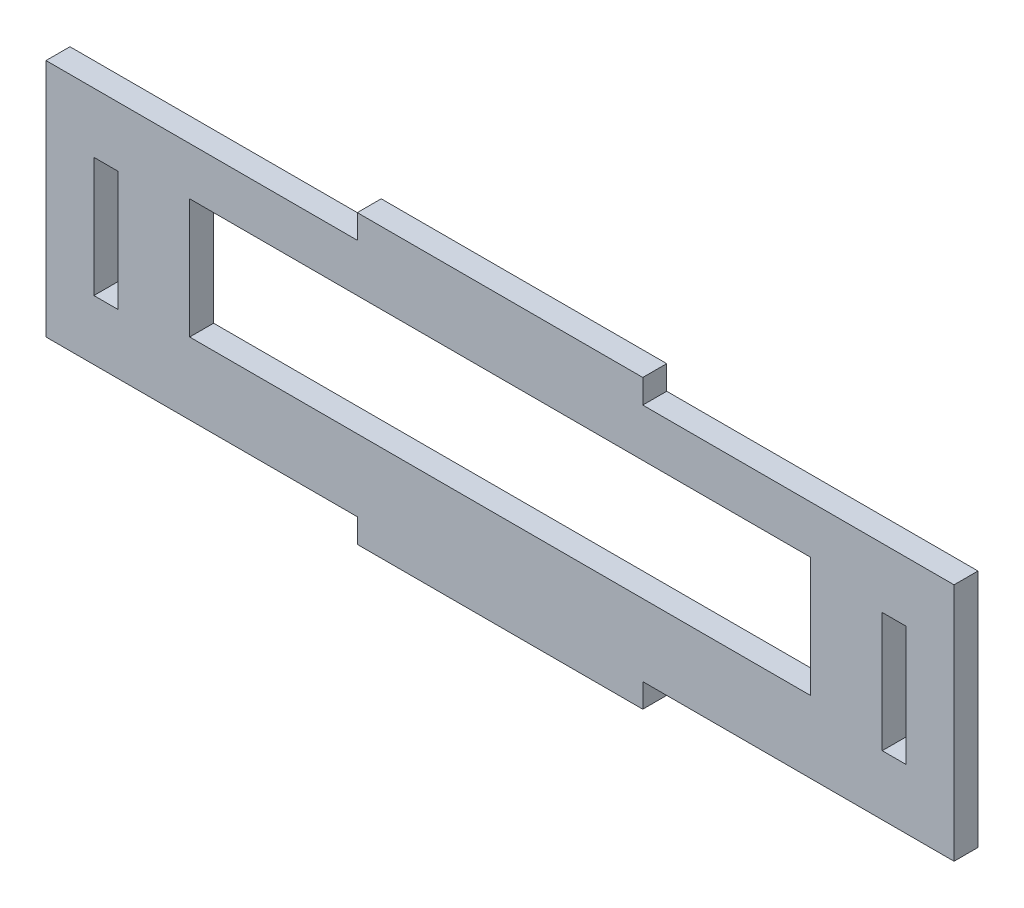
from build123d import *

# Parameters (mm, degrees)
SKETCH1_W           = 51.848
SKETCH1_H           = 10
SKETCH1_W_2         = 2
BOSS_EXTRUDE1_DEPTH = 2


with BuildPart() as part:
    # Sketch1 → Boss-Extrude1 (new body)
    with BuildSketch(Plane.XY):
        Polygon((0, 0), (24, 0), (24, -2), (47.848, -2), (47.848, 0), (71.848, 0), (73.848, 0), (73.848, 20), (71.848, 20), (47.848, 20), (47.848, 22), (24, 22), (24, 20), (0, 20), (-2, 20), (-2, 0), align=None)
        with Locations((35.924, 11)):
            Rectangle(SKETCH1_W, SKETCH1_H, mode=Mode.SUBTRACT)
        with Locations((3, 10)):
            Rectangle(SKETCH1_W_2, SKETCH1_H, mode=Mode.SUBTRACT)
        with Locations((68.848, 10)):
            Rectangle(SKETCH1_W_2, SKETCH1_H, mode=Mode.SUBTRACT)
    extrude(amount=BOSS_EXTRUDE1_DEPTH)


solid = part.part
